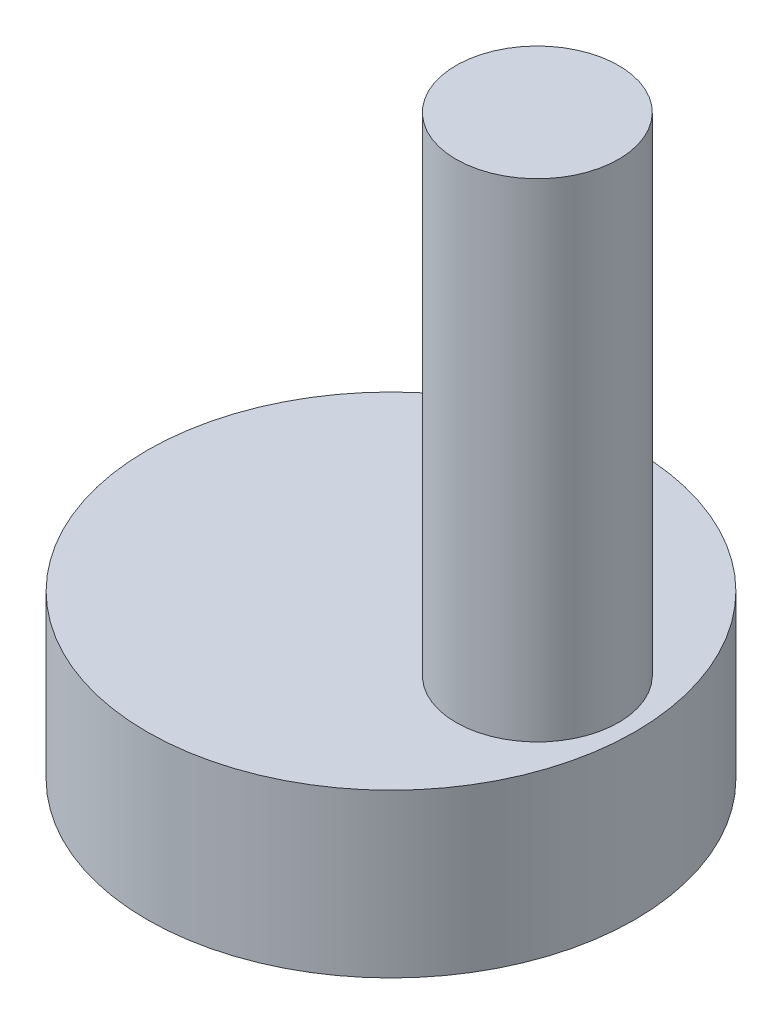
from build123d import *

# Parameters (mm, degrees)
SKETCH1_R           = 15
BOSS_EXTRUDE1_DEPTH = 10
SKETCH2_R           = 5
BOSS_EXTRUDE2_DEPTH = 30


with BuildPart() as part:
    # Sketch1 → Boss-Extrude1 (new body)
    with BuildSketch(Plane(origin=(0, 0, 0), x_dir=(1, 0, 0), z_dir=(0, 1, 0))):
        with Locations(Location((0, 0, 0), (0, 0, 270))):
            Circle(SKETCH1_R)
    extrude(amount=BOSS_EXTRUDE1_DEPTH)

    # Sketch2 → Boss-Extrude2 (add)
    with BuildSketch(Plane(origin=(0, 10, 0), x_dir=(1, 0, 0), z_dir=(0, 1, 0))):
        with Locations(Location((9, 0, 0), (0, 0, 270))):
            Circle(SKETCH2_R)
    extrude(amount=BOSS_EXTRUDE2_DEPTH)


solid = part.part
